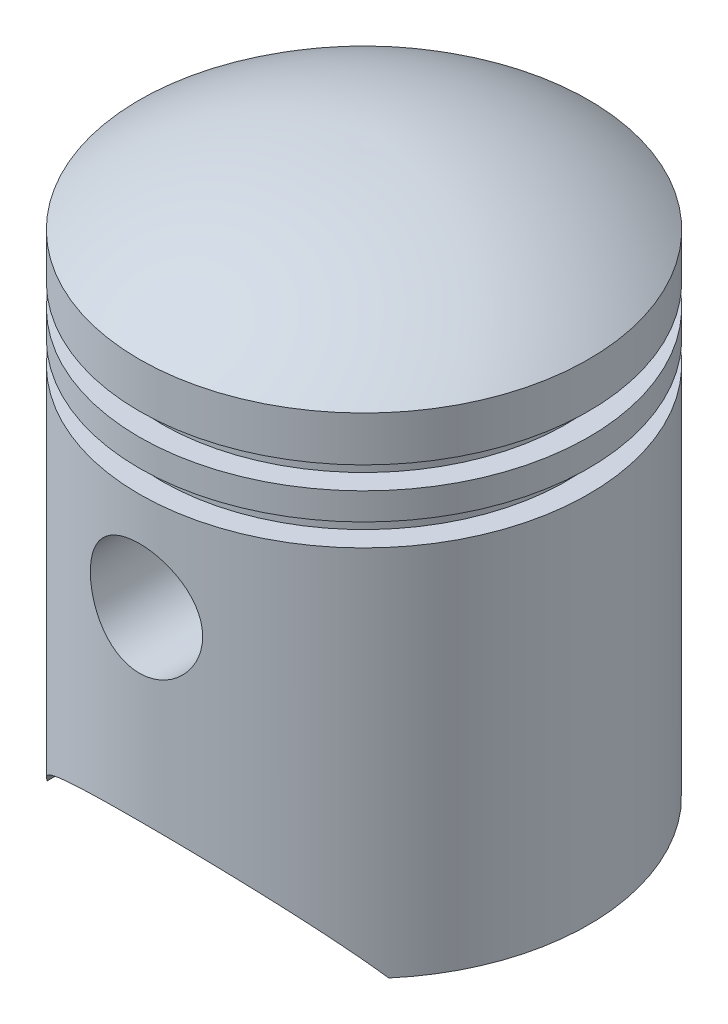
from build123d import *

# Parameters (mm, degrees)
CUT_EXTRUDE1_DEPTH       = 63.019965438
CUT_EXTRUDE1_DEPTH_BACK  = 63.019965438
SKETCH2_R                = 6.25
BOSS_EXTRUDE1_REACH      = 76.02
BOSS_EXTRUDE1_END_RADIUS = 23
BOSS_EXTRUDE1_START      = 12
SKETCH3_R                = 7.25
SKETCH3_R_2              = 6.25


with BuildPart() as part:
    # Sketch1 → Revolve1 (revolve)
    with BuildSketch(Plane.XY, mode=Mode.PRIVATE) as revolve1_sk:
        with BuildLine():
            Line((25, 42.943526769), (25, 37.943526769))
            Line((25, 37.943526769), (22.5, 37.943526769))
            Line((22.5, 37.943526769), (22.5, 35.443526769))
            Line((22.5, 35.443526769), (25, 35.443526769))
            Line((25, 35.443526769), (25, 32.443526769))
            Line((25, 32.443526769), (22.5, 32.443526769))
            Line((22.5, 32.443526769), (22.5, 29.943526769))
            Line((22.5, 29.943526769), (25, 29.943526769))
            Line((25, 29.943526769), (25, -11.556473231))
            Line((25, -11.556473231), (23, -11.556473231))
            Line((23, -11.556473231), (23, 27.943526769))
            Line((23, 27.943526769), (20.5, 27.943526769))
            Line((20.5, 27.943526769), (20.5, 33.943526769))
            Line((20.5, 33.943526769), (20.5, 39.943526769))
            Line((20.5, 39.943526769), (23, 39.943526769))
            Line((23, 39.943526769), (23, 41.928037914))
            ThreePointArc((23, 41.928037914), (12.069492637, 47.302692214), (0, 48.942889619))
            Line((0, 48.942889619), (0, 50.943526769))
            ThreePointArc((0, 50.943526769), (13.174901691, 49.052594554), (25, 42.943526769))
        make_face()
    revolve(revolve1_sk.sketch.rotate(Axis((0, 50.943526769, 0), (0, -1, 0)), 90), axis=Axis((0, 50.943526769, 0), (0, -1, 0)))

    # Sketch2 → Cut-Extrude1 (cut, two sides: drawn at the far end of the back side and taken through both)
    with BuildSketch(Plane.XY.offset(-CUT_EXTRUDE1_DEPTH_BACK)):
        with Locations((0, 18.943526769)):
            Circle(SKETCH2_R)
        with BuildLine():
            Line((-19, -11.556473231), (19, -11.556473231))
            ThreePointArc((19, -11.556473231), (0, -1.556473231), (-19, -11.556473231))
        make_face()
    extrude(amount=CUT_EXTRUDE1_DEPTH + CUT_EXTRUDE1_DEPTH_BACK, mode=Mode.SUBTRACT)

    # Boss-Extrude1: up to this cylinder (the profile starts inside it)
    boss_extrude1_end = Plane(origin=(0, 11.898588, 0), z_dir=(0, 1, 0)) * Cylinder(BOSS_EXTRUDE1_END_RADIUS, 199.04, mode=Mode.PRIVATE)
    # Sketch3 → Boss-Extrude1 (add, up to the surface)
    with BuildSketch(Plane.XY.offset(BOSS_EXTRUDE1_START), mode=Mode.PRIVATE) as boss_extrude1_sk1:
        with Locations(Location((0, 18.943526769, 0), (0, 0, 90))):
            Circle(SKETCH3_R)
        with Locations((0, 18.943526769)):
            Circle(SKETCH3_R_2, mode=Mode.SUBTRACT)
    boss_extrude1_tool1 = extrude(boss_extrude1_sk1.sketch, amount=BOSS_EXTRUDE1_REACH, mode=Mode.PRIVATE) & boss_extrude1_end
    boss_extrude1 = boss_extrude1_tool1.solids().sort_by_distance((0, 11.898588, 12))[0]
    add(boss_extrude1)

    # Mirror1: Boss-Extrude1 across plane
    add(boss_extrude1.mirror(Plane.XY))


solid = part.part
